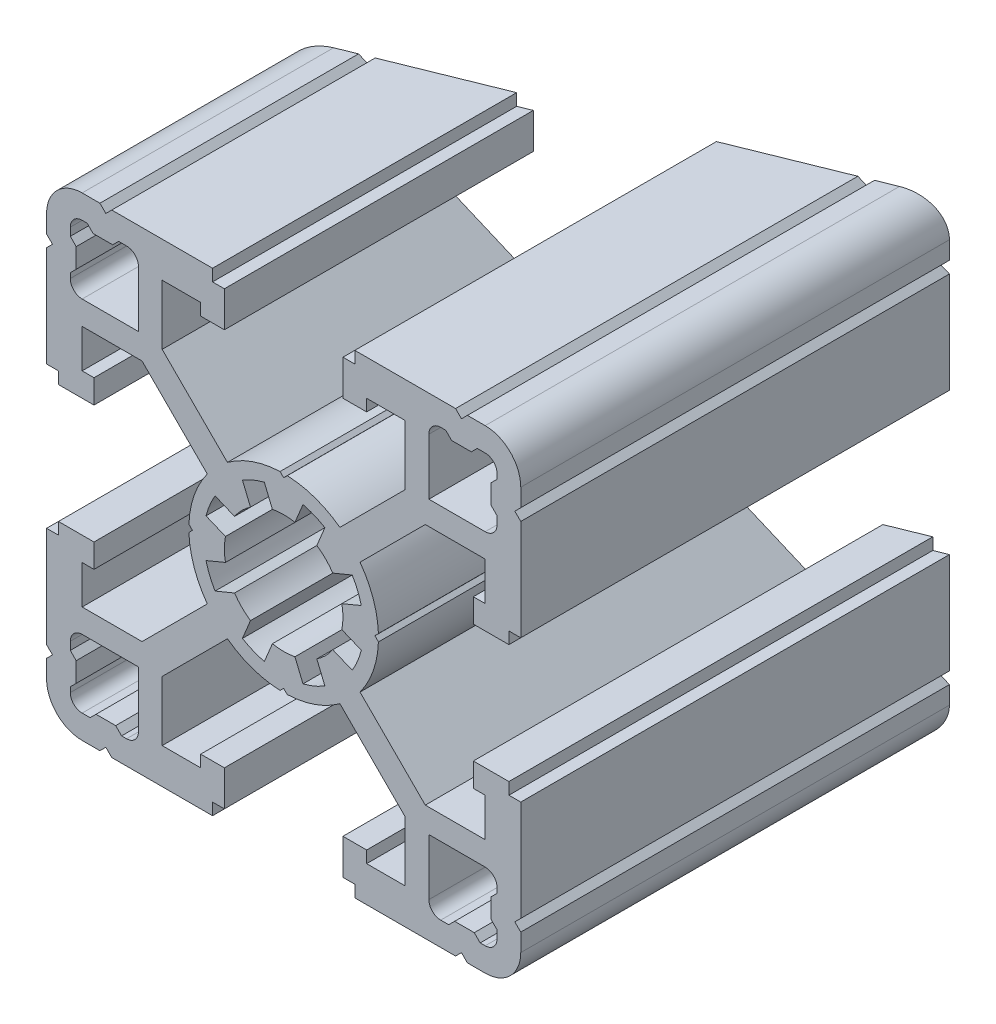
from build123d import *

# Parameters (mm, degrees)
BOSS_EXTRUDE1_DEPTH     = 100
CUT_EXTRUDE1_DEPTH      = 110.544511501
CUT_EXTRUDE1_DEPTH_BACK = 110.544511501


with BuildPart() as part:
    # Sketch1 → Boss-Extrude1 (new body)
    with BuildSketch(Plane.XY.offset(100)):
        with BuildLine():
            Line((-6, 19), (-6, 20))
            Line((-6, 20), (-14.5, 20))
            Line((-14.5, 20), (-15, 19.5))
            Line((-15, 19.5), (-15.5, 20))
            Line((-15.5, 20), (-17, 20))
            ThreePointArc((-17, 20), (-19.121320344, 19.121320344), (-20, 17))
            Line((-20, 17), (-20, 15.5))
            Line((-20, 15.5), (-19.5, 15))
            Line((-19.5, 15), (-20, 14.5))
            Line((-20, 14.5), (-20, 6))
            Line((-20, 6), (-19, 6))
            Line((-19, 6), (-19, 5))
            Line((-19, 5), (-16.000000002, 5))
            Line((-16.000000002, 5), (-16.000000002, 7.000000003))
            Line((-16.000000002, 7.000000003), (-17.000000002, 7.000000003))
            Line((-17.000000002, 7.000000003), (-17.000000002, 10.250000002))
            Line((-17.000000002, 10.250000002), (-11.947056276, 10.250000002))
            Line((-11.947056276, 10.250000002), (-6.441380719, 4.744324446))
            ThreePointArc((-6.441380719, 4.744324446), (-7.551143818, 2.642011935), (-7.994130058, 0.30640597))
            Line((-7.994130058, 0.30640597), (-7.7, 1e-09))
            Line((-7.7, 1e-09), (-7.994130058, -0.30640597))
            ThreePointArc((-7.994130058, -0.30640597), (-7.551143818, -2.642011931), (-6.441380721, -4.744324441))
            Line((-6.441380721, -4.744324441), (-11.947056277, -10.249999997))
            Line((-11.947056277, -10.249999997), (-17.000000002, -10.249999997))
            Line((-17.000000002, -10.249999997), (-17.000000002, -6.999999997))
            Line((-17.000000002, -6.999999997), (-16.000000002, -6.999999997))
            Line((-16.000000002, -6.999999997), (-16.000000002, -5))
            Line((-16.000000002, -5), (-19, -5))
            Line((-19, -5), (-19, -6))
            Line((-19, -6), (-20, -6))
            Line((-20, -6), (-20, -14.5))
            Line((-20, -14.5), (-19.5, -15))
            Line((-19.5, -15), (-20, -15.5))
            Line((-20, -15.5), (-20, -17))
            ThreePointArc((-20, -17), (-19.121320344, -19.121320344), (-17, -20))
            Line((-17, -20), (-15.5, -20))
            Line((-15.5, -20), (-15, -19.5))
            Line((-15, -19.5), (-14.5, -20))
            Line((-14.5, -20), (-6, -20))
            Line((-6, -20), (-6, -19))
            Line((-6, -19), (-5, -19))
            Line((-5, -19), (-5, -16))
            Line((-5, -16), (-7, -16))
            Line((-7, -16), (-7, -17))
            Line((-7, -17), (-10.25, -17))
            Line((-10.25, -17), (-10.25, -11.947056273))
            Line((-10.25, -11.947056273), (-4.744324445, -6.441380718))
            ThreePointArc((-4.744324445, -6.441380718), (-2.642011934, -7.551143816), (-0.30640597, -7.994130057))
            Line((-0.30640597, -7.994130057), (-1e-09, -7.699999999))
            Line((-1e-09, -7.699999999), (0.30640597, -7.994130057))
            ThreePointArc((0.30640597, -7.994130057), (2.642011933, -7.551143815), (4.744324444, -6.441380718))
            Line((4.744324444, -6.441380718), (10.249999997, -11.947056271))
            Line((10.249999997, -11.947056271), (10.249999997, -17))
            Line((10.249999997, -17), (7, -17))
            Line((7, -17), (7, -16))
            Line((7, -16), (5, -16))
            Line((5, -16), (5, -19))
            Line((5, -19), (6, -19))
            Line((6, -19), (6, -20))
            Line((6, -20), (14.5, -20))
            Line((14.5, -20), (15, -19.5))
            Line((15, -19.5), (15.5, -20))
            Line((15.5, -20), (17, -20))
            ThreePointArc((17, -20), (19.121320344, -19.121320344), (20, -17))
            Line((20, -17), (20, -15.5))
            Line((20, -15.5), (19.5, -15))
            Line((19.5, -15), (20, -14.5))
            Line((20, -14.5), (20, -6))
            Line((20, -6), (19, -6))
            Line((19, -6), (19, -5))
            Line((19, -5), (15.999999998, -5))
            Line((15.999999998, -5), (15.999999998, -6.999999997))
            Line((15.999999998, -6.999999997), (16.999999998, -6.999999997))
            Line((16.999999998, -6.999999997), (16.999999998, -10.249999997))
            Line((16.999999998, -10.249999997), (11.947056271, -10.249999997))
            Line((11.947056271, -10.249999997), (6.441380718, -4.744324443))
            ThreePointArc((6.441380718, -4.744324443), (7.551143816, -2.642011932), (7.994130057, -0.306405968))
            Line((7.994130057, -0.306405968), (7.699999999, 1e-09))
            Line((7.699999999, 1e-09), (7.994130057, 0.306405972))
            ThreePointArc((7.994130057, 0.306405972), (7.551143816, 2.642011935), (6.441380719, 4.744324445))
            Line((6.441380719, 4.744324445), (11.947056276, 10.250000002))
            Line((11.947056276, 10.250000002), (16.999999998, 10.250000002))
            Line((16.999999998, 10.250000002), (16.999999998, 7.000000003))
            Line((16.999999998, 7.000000003), (15.999999998, 7.000000003))
            Line((15.999999998, 7.000000003), (15.999999998, 5))
            Line((15.999999998, 5), (19, 5))
            Line((19, 5), (19, 6))
            Line((19, 6), (20, 6))
            Line((20, 6), (20, 14.5))
            Line((20, 14.5), (19.5, 15))
            Line((19.5, 15), (20, 15.5))
            Line((20, 15.5), (20, 17))
            ThreePointArc((20, 17), (19.121320344, 19.121320344), (17, 20))
            Line((17, 20), (15.5, 20))
            Line((15.5, 20), (15, 19.5))
            Line((15, 19.5), (14.5, 20))
            Line((14.5, 20), (6, 20))
            Line((6, 20), (6, 19))
            Line((6, 19), (5, 19))
            Line((5, 19), (5, 16))
            Line((5, 16), (7, 16))
            Line((7, 16), (7, 17))
            Line((7, 17), (10.249999997, 17))
            Line((10.249999997, 17), (10.249999997, 11.947056278))
            Line((10.249999997, 11.947056278), (4.744324442, 6.441380722))
            ThreePointArc((4.744324442, 6.441380722), (2.642011931, 7.551143819), (0.306405969, 7.994130059))
            Line((0.306405969, 7.994130059), (-1e-09, 7.700000001))
            Line((-1e-09, 7.700000001), (-0.306405971, 7.994130059))
            ThreePointArc((-0.306405971, 7.994130059), (-2.642011935, 7.551143818), (-4.744324445, 6.44138072))
            Line((-4.744324445, 6.44138072), (-10.25, 11.947056275))
            Line((-10.25, 11.947056275), (-10.25, 17))
            Line((-10.25, 17), (-7, 17))
            Line((-7, 17), (-7, 16))
            Line((-7, 16), (-5, 16))
            Line((-5, 16), (-5, 19))
            Line((-5, 19), (-6, 19))
        make_face()
        with BuildLine():
            Line((17, 12.25), (12.25, 12.25))
            Line((12.25, 12.25), (12.25, 17))
            ThreePointArc((12.25, 17), (12.542893219, 17.707106781), (13.25, 18))
            Line((13.25, 18), (13.671572875, 18))
            Line((13.671572875, 18), (14.171572875, 17.5))
            Line((14.171572875, 17.5), (15.828427125, 17.5))
            Line((15.828427125, 17.5), (16.328427125, 18))
            Line((16.328427125, 18), (17, 18))
            ThreePointArc((17, 18), (17.707106781, 17.707106781), (18, 17))
            Line((18, 17), (18, 16.578427125))
            Line((18, 16.578427125), (17.5, 16.078427125))
            Line((17.5, 16.078427125), (17.5, 14.421572875))
            Line((17.5, 14.421572875), (18, 13.921572875))
            Line((18, 13.921572875), (18, 13.25))
            ThreePointArc((18, 13.25), (17.707106781, 12.542893219), (17, 12.25))
        make_face(mode=Mode.SUBTRACT)
        with BuildLine():
            Line((-17, -12.25), (-12.25, -12.25))
            Line((-12.25, -12.25), (-12.25, -17))
            ThreePointArc((-12.25, -17), (-12.542893219, -17.707106781), (-13.25, -18))
            Line((-13.25, -18), (-13.671572875, -18))
            Line((-13.671572875, -18), (-14.171572875, -17.5))
            Line((-14.171572875, -17.5), (-15.828427125, -17.5))
            Line((-15.828427125, -17.5), (-16.328427125, -18))
            Line((-16.328427125, -18), (-17, -18))
            ThreePointArc((-17, -18), (-17.707106781, -17.707106781), (-18, -17))
            Line((-18, -17), (-18, -16.578427125))
            Line((-18, -16.578427125), (-17.5, -16.078427125))
            Line((-17.5, -16.078427125), (-17.5, -14.421572875))
            Line((-17.5, -14.421572875), (-18, -13.921572875))
            Line((-18, -13.921572875), (-18, -13.25))
            ThreePointArc((-18, -13.25), (-17.707106781, -12.542893219), (-17, -12.25))
        make_face(mode=Mode.SUBTRACT)
        with BuildLine():
            Line((-12.25, 17), (-12.25, 12.25))
            Line((-12.25, 12.25), (-17, 12.25))
            ThreePointArc((-17, 12.25), (-17.707106781, 12.542893219), (-18, 13.25))
            Line((-18, 13.25), (-18, 13.671572875))
            Line((-18, 13.671572875), (-17.5, 14.171572875))
            Line((-17.5, 14.171572875), (-17.5, 15.828427125))
            Line((-17.5, 15.828427125), (-18, 16.328427125))
            Line((-18, 16.328427125), (-18, 17))
            ThreePointArc((-18, 17), (-17.707106781, 17.707106781), (-17, 18))
            Line((-17, 18), (-16.578427125, 18))
            Line((-16.578427125, 18), (-16.078427125, 17.5))
            Line((-16.078427125, 17.5), (-14.421572875, 17.5))
            Line((-14.421572875, 17.5), (-13.921572875, 18))
            Line((-13.921572875, 18), (-13.25, 18))
            ThreePointArc((-13.25, 18), (-12.542893219, 17.707106781), (-12.25, 17))
        make_face(mode=Mode.SUBTRACT)
        with BuildLine():
            Line((12.25, -17), (12.25, -12.25))
            Line((12.25, -12.25), (17, -12.25))
            ThreePointArc((17, -12.25), (17.707106781, -12.542893219), (18, -13.25))
            Line((18, -13.25), (18, -13.671572875))
            Line((18, -13.671572875), (17.5, -14.171572875))
            Line((17.5, -14.171572875), (17.5, -15.828427125))
            Line((17.5, -15.828427125), (18, -16.328427125))
            Line((18, -16.328427125), (18, -17))
            ThreePointArc((18, -17), (17.707106781, -17.707106781), (17, -18))
            Line((17, -18), (16.578427125, -18))
            Line((16.578427125, -18), (16.078427125, -17.5))
            Line((16.078427125, -17.5), (14.421572875, -17.5))
            Line((14.421572875, -17.5), (13.921572875, -18))
            Line((13.921572875, -18), (13.25, -18))
            ThreePointArc((13.25, -18), (12.542893219, -17.707106781), (12.25, -17))
        make_face(mode=Mode.SUBTRACT)
        with BuildLine():
            Line((1.630729445, -6.550055073), (0.950878752, -4.908750308))
            ThreePointArc((0.950878752, -4.908750308), (-1e-09, -4.999999999), (-0.950878753, -4.908750308))
            Line((-0.950878753, -4.908750308), (-1.630729447, -6.550055073))
            ThreePointArc((-1.630729447, -6.550055073), (-2.583113169, -6.236186844), (-3.478488511, -5.784688209))
            Line((-3.478488511, -5.784688209), (-2.798637817, -4.143383444))
            ThreePointArc((-2.798637817, -4.143383444), (-3.535533906, -3.535533905), (-4.143383445, -2.798637816))
            Line((-4.143383445, -2.798637816), (-5.784688211, -3.478488509))
            ThreePointArc((-5.784688211, -3.478488509), (-6.236186846, -2.583113167), (-6.550055075, -1.630729444))
            Line((-6.550055075, -1.630729444), (-4.90875031, -0.95087875))
            ThreePointArc((-4.90875031, -0.95087875), (-5.000000001, 2e-09), (-4.90875031, 0.950878754))
            Line((-4.90875031, 0.950878754), (-6.550055075, 1.630729448))
            ThreePointArc((-6.550055075, 1.630729448), (-6.236186845, 2.58311317), (-5.78468821, 3.478488512))
            Line((-5.78468821, 3.478488512), (-4.143383445, 2.798637818))
            ThreePointArc((-4.143383445, 2.798637818), (-3.535533907, 3.535533907), (-2.798637818, 4.143383446))
            Line((-2.798637818, 4.143383446), (-3.478488511, 5.784688211))
            ThreePointArc((-3.478488511, 5.784688211), (-2.583113168, 6.236186846), (-1.630729445, 6.550055076))
            Line((-1.630729445, 6.550055076), (-0.950878752, 4.908750311))
            ThreePointArc((-0.950878752, 4.908750311), (0, 5.000000001), (0.950878751, 4.908750311))
            Line((0.950878751, 4.908750311), (1.630729445, 6.550055076))
            ThreePointArc((1.630729445, 6.550055076), (2.583113168, 6.236186846), (3.47848851, 5.784688211))
            Line((3.47848851, 5.784688211), (2.798637817, 4.143383446))
            ThreePointArc((2.798637817, 4.143383446), (3.535533906, 3.535533907), (4.143383444, 2.798637818))
            Line((4.143383444, 2.798637818), (5.784688209, 3.478488512))
            ThreePointArc((5.784688209, 3.478488512), (6.236186844, 2.58311317), (6.550055074, 1.630729448))
            Line((6.550055074, 1.630729448), (4.908750309, 0.950878754))
            ThreePointArc((4.908750309, 0.950878754), (5, 1e-09), (4.908750309, -0.950878752))
            Line((4.908750309, -0.950878752), (6.550055074, -1.630729445))
            ThreePointArc((6.550055074, -1.630729445), (6.236186844, -2.583113168), (5.784688209, -3.478488511))
            Line((5.784688209, -3.478488511), (4.143383444, -2.798637817))
            ThreePointArc((4.143383444, -2.798637817), (3.535533905, -3.535533905), (2.798637816, -4.143383444))
            Line((2.798637816, -4.143383444), (3.47848851, -5.784688209))
            ThreePointArc((3.47848851, -5.784688209), (2.583113168, -6.236186844), (1.630729445, -6.550055073))
        make_face(mode=Mode.SUBTRACT)
    extrude(amount=-BOSS_EXTRUDE1_DEPTH)

    # Sketch2 → Cut-Extrude1 (cut, two sides: drawn at the far end of the back side and taken through both)
    with BuildSketch(Plane(origin=(0, 20, 0), x_dir=(1, 0, 0), z_dir=(0, 1, 0)).offset(-CUT_EXTRUDE1_DEPTH_BACK)):
        Polygon((-20, -80), (20, -63.838950967), (20, 0), (-20, 0), align=None)
    extrude(amount=CUT_EXTRUDE1_DEPTH + CUT_EXTRUDE1_DEPTH_BACK, mode=Mode.SUBTRACT)


solid = part.part
